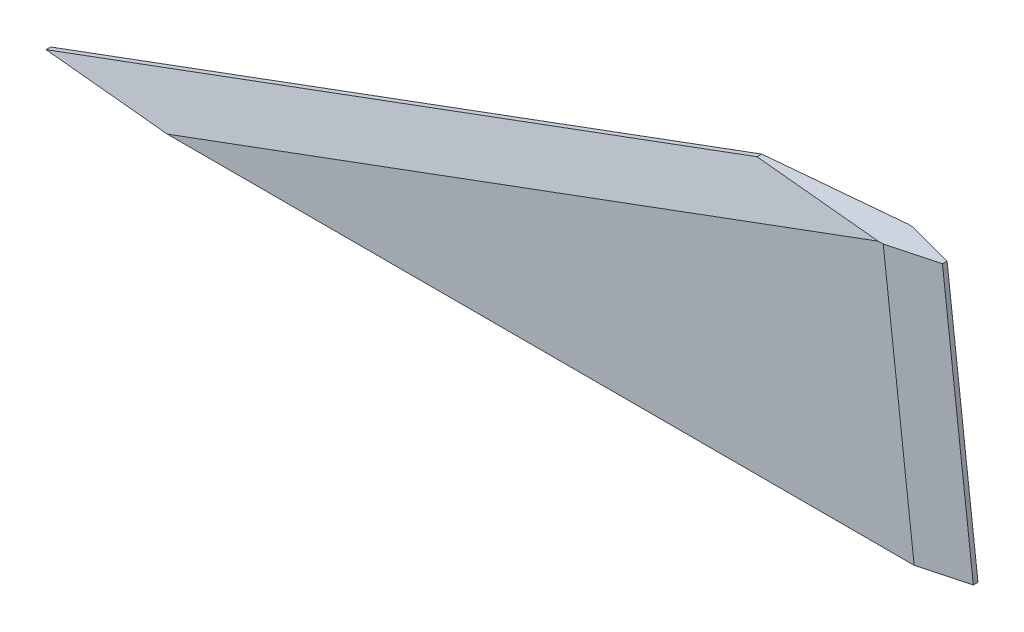
from build123d import *
from OCP.BRepFilletAPI import BRepFilletAPI_MakeChamfer

# Parameters (mm, degrees)
BOSS_EXTRUDE1_DEPTH = 1.2192
CHAMFER1_SIZE       = 3.81
CHAMFER1_SIZE2      = 1.0287
CHAMFER2_SIZE       = 3.81
CHAMFER2_SIZE2      = 1.0287


with BuildPart() as part:
    # Sketch1 → Boss-Extrude1 (new, symmetric)
    with BuildSketch(Plane.XY):
        Polygon((0, 0), (58.42, 21.59), (73.66, 21.59), (76.2, 0), align=None)
    extrude(amount=BOSS_EXTRUDE1_DEPTH, both=True)

    # Chamfer1: one chamfer whose edges measure the first distance from different faces: ONE call of the kernel's chamfer builder (chamfer() names one face for all edges)
    chamfer1_edges_1 = [part.edges().sort_by_distance(p)[0] for p in [
        (29.21, 10.795, 1.2192),
    ]]
    chamfer1_side_1 = [part.faces().sort_by_distance(p)[0] for p in [
        (48.965555556, 8.396111111, 1.2192),
    ]]
    chamfer1_edges_2 = [part.edges().sort_by_distance(p)[0] for p in [
        (29.21, 10.795, -1.2192),
    ]]
    chamfer1_side_2 = [part.faces().sort_by_distance(p)[0] for p in [
        (48.965555556, 8.396111111, -1.2192),
    ]]
    chamfer1 = BRepFilletAPI_MakeChamfer(part.part.solid().wrapped)
    for e in chamfer1_edges_1:
        chamfer1.Add(CHAMFER1_SIZE, CHAMFER1_SIZE2, e.wrapped, chamfer1_side_1[0].wrapped)  # the first distance lies on this face
    for e in chamfer1_edges_2:
        chamfer1.Add(CHAMFER1_SIZE, CHAMFER1_SIZE2, e.wrapped, chamfer1_side_2[0].wrapped)  # the first distance lies on this face
    add(Compound.cast(chamfer1.Shape()), mode=Mode.REPLACE)

    # Chamfer2: one chamfer whose edges measure the first distance from different faces: ONE call of the kernel's chamfer builder (chamfer() names one face for all edges)
    chamfer2_edges_1 = [part.edges().sort_by_distance(p)[0] for p in [
        (74.93, 10.795, -1.2192),
    ]]
    chamfer2_side_1 = [part.faces().sort_by_distance(p)[0] for p in [
        (53.47852905, 7.636921414, -1.2192),
    ]]
    chamfer2_edges_2 = [part.edges().sort_by_distance(p)[0] for p in [
        (74.93, 10.795, 1.2192),
    ]]
    chamfer2_side_2 = [part.faces().sort_by_distance(p)[0] for p in [
        (53.47852905, 7.636921414, 1.2192),
    ]]
    chamfer2 = BRepFilletAPI_MakeChamfer(part.part.solid().wrapped)
    for e in chamfer2_edges_1:
        chamfer2.Add(CHAMFER2_SIZE, CHAMFER2_SIZE2, e.wrapped, chamfer2_side_1[0].wrapped)  # the first distance lies on this face
    for e in chamfer2_edges_2:
        chamfer2.Add(CHAMFER2_SIZE, CHAMFER2_SIZE2, e.wrapped, chamfer2_side_2[0].wrapped)  # the first distance lies on this face
    add(Compound.cast(chamfer2.Shape()), mode=Mode.REPLACE)


solid = part.part
